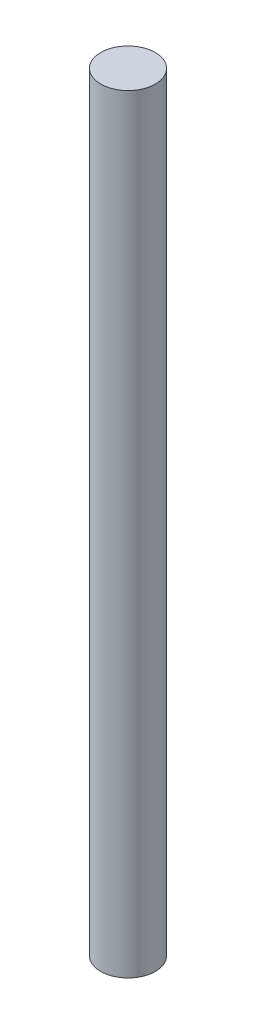
from build123d import *

# Parameters (mm, degrees)
IZIM1_R                     = 1.6
Y_KSEKLIK_EKSTR_ZYON1_DEPTH = 45


with BuildPart() as part:
    # Çizim1 → Yükseklik-Ekstrüzyon1 (new body)
    with BuildSketch(Plane(origin=(0, 0, 0), x_dir=(1, 0, 0), z_dir=(0, 1, 0))):
        with Locations(Location((0, 0, 0), (0, 0, 90))):
            Circle(IZIM1_R)
    extrude(amount=Y_KSEKLIK_EKSTR_ZYON1_DEPTH)


solid = part.part
